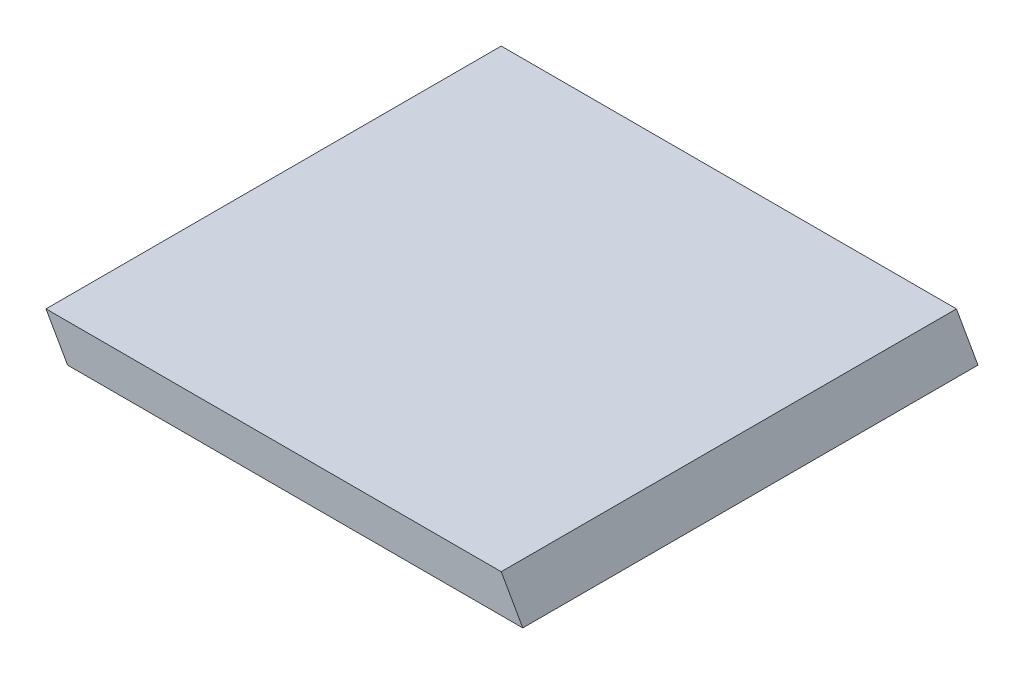
from build123d import *


with BuildPart() as part:
    # Sketch2 → Loft1 section 0
    with BuildSketch(Plane(origin=(0, 0.635, 0), x_dir=(1, 0, 0), z_dir=(0, 1, 0))):
        with BuildLine():
            Line((-4.171044505, 3.81), (3.448955495, 3.81))
            Line((3.448955495, 3.81), (3.448955495, -3.81))
            Line((3.448955495, -3.81), (-4.171044505, -3.81))
            Line((-4.171044505, -3.81), (-4.171044505, 3.81))
        make_face()
    # Sketch1 → Loft1 section 1
    with BuildSketch(Plane(origin=(0, 0, 0), x_dir=(1, 0, 0), z_dir=(0, 1, 0))):
        with BuildLine():
            Line((-3.81, -3.81), (3.81, -3.81))
            Line((3.81, -3.81), (3.81, 3.81))
            Line((3.81, 3.81), (-3.81, 3.81))
            Line((-3.81, 3.81), (-3.81, -3.81))
        make_face()
    loft()


solid = part.part
